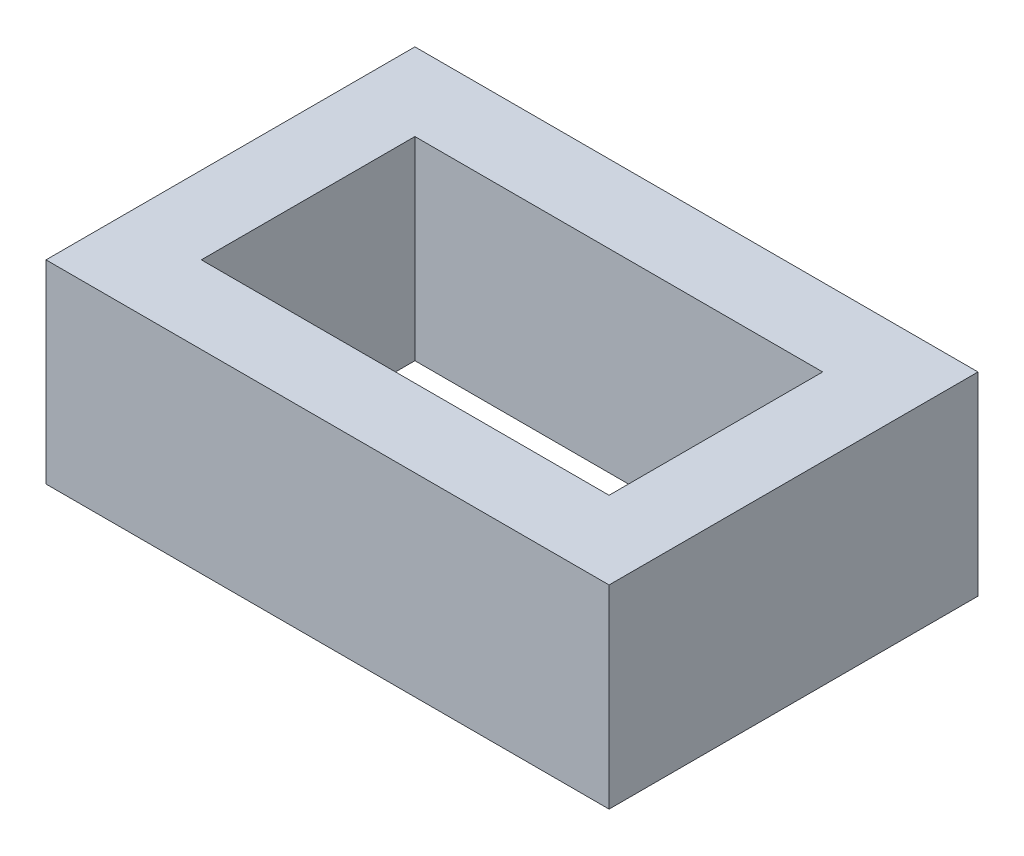
from build123d import *

# Parameters (mm, degrees)
SKETCH1_W           = 14.5
SKETCH1_H           = 9.5
SKETCH1_W_2         = 10.5
SKETCH1_H_2         = 5.5
BOSS_EXTRUDE1_DEPTH = 5


with BuildPart() as part:
    # Sketch1 → Boss-Extrude1 (new body)
    with BuildSketch(Plane(origin=(0, 0, 0), x_dir=(1, 0, 0), z_dir=(0, 1, 0))):
        Rectangle(SKETCH1_W, SKETCH1_H)
        Rectangle(SKETCH1_W_2, SKETCH1_H_2, mode=Mode.SUBTRACT)
    extrude(amount=BOSS_EXTRUDE1_DEPTH)


solid = part.part
